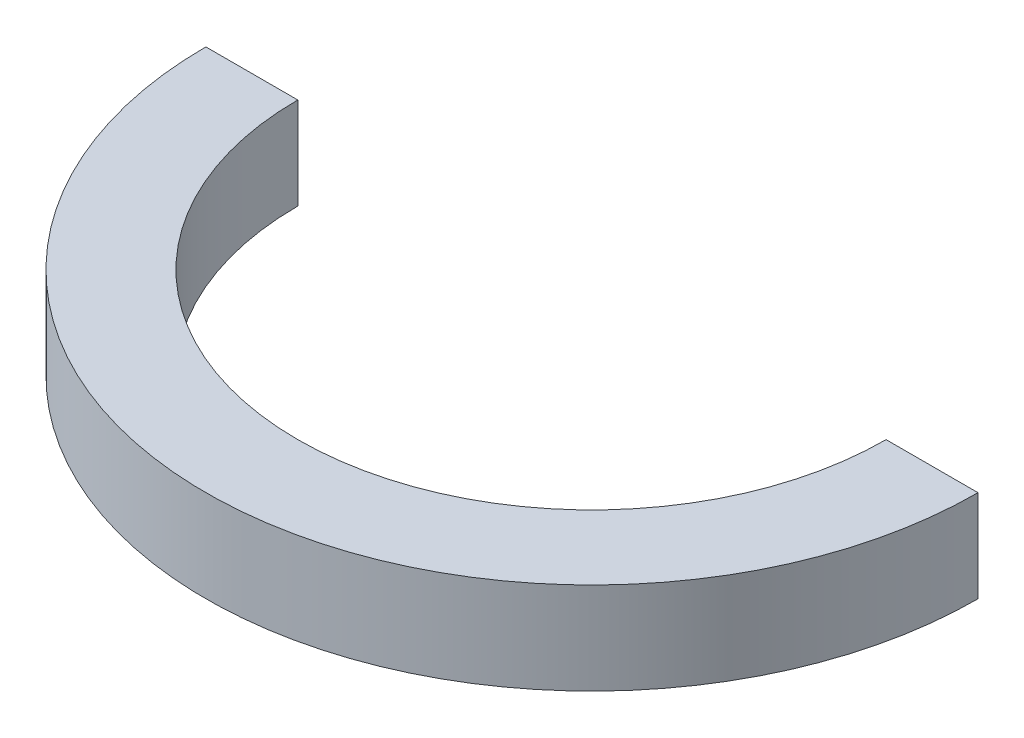
from build123d import *

# Parameters (mm, degrees)
EXTRUDE_1_DEPTH = 10


with BuildPart() as part:
    # Эскиз1 → Вытянуть-Тонкостенный1 (new body)
    with BuildSketch(Plane(origin=(0, 0, 0), x_dir=(1, 0, 0), z_dir=(0, 1, 0))):
        with BuildLine():
            ThreePointArc((-32, 0), (0, -32), (32, 0))
            Line((32, 0), (42, 0))
            ThreePointArc((42, 0), (0, -42), (-42, 0))
            Line((-42, 0), (-32, 0))
        make_face()
    extrude(amount=EXTRUDE_1_DEPTH)


solid = part.part
